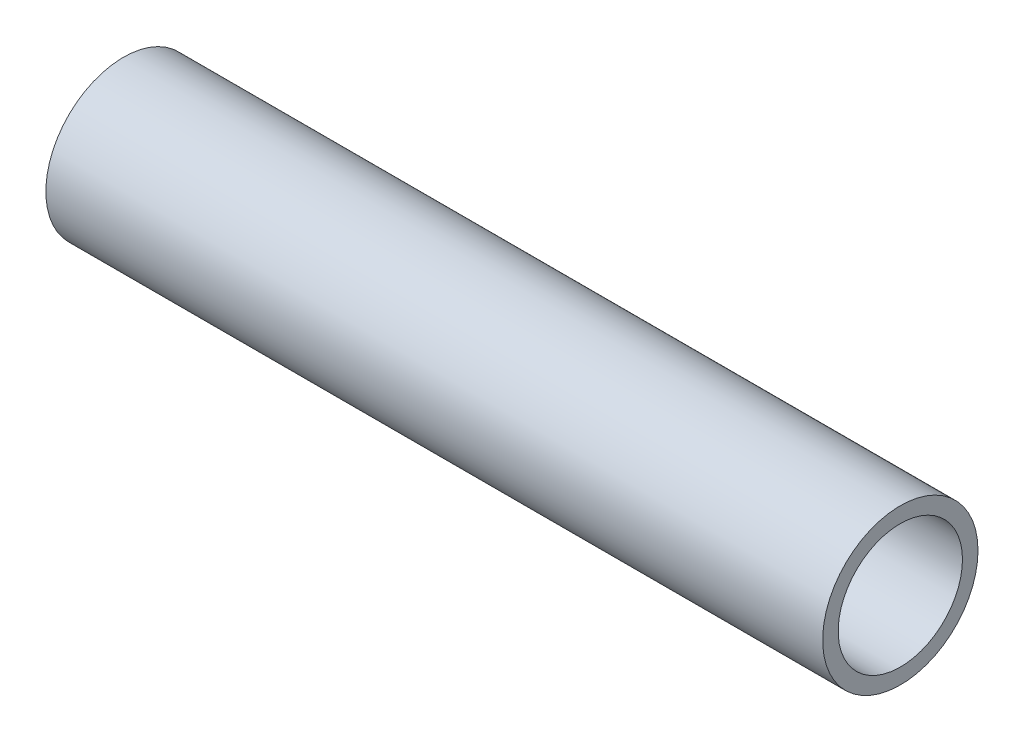
from build123d import *

# Parameters (mm, degrees)
SKETCH1_R           = 5
SKETCH1_R_2         = 4
BOSS_EXTRUDE2_DEPTH = 25


with BuildPart() as part:
    # Sketch1 → Boss-Extrude2 (new, symmetric)
    with BuildSketch(Plane(origin=(0, 0, 0), x_dir=(0, 0, -1), z_dir=(1, 0, 0))):
        Circle(SKETCH1_R)
        Circle(SKETCH1_R_2, mode=Mode.SUBTRACT)
    extrude(amount=BOSS_EXTRUDE2_DEPTH, both=True)


solid = part.part
